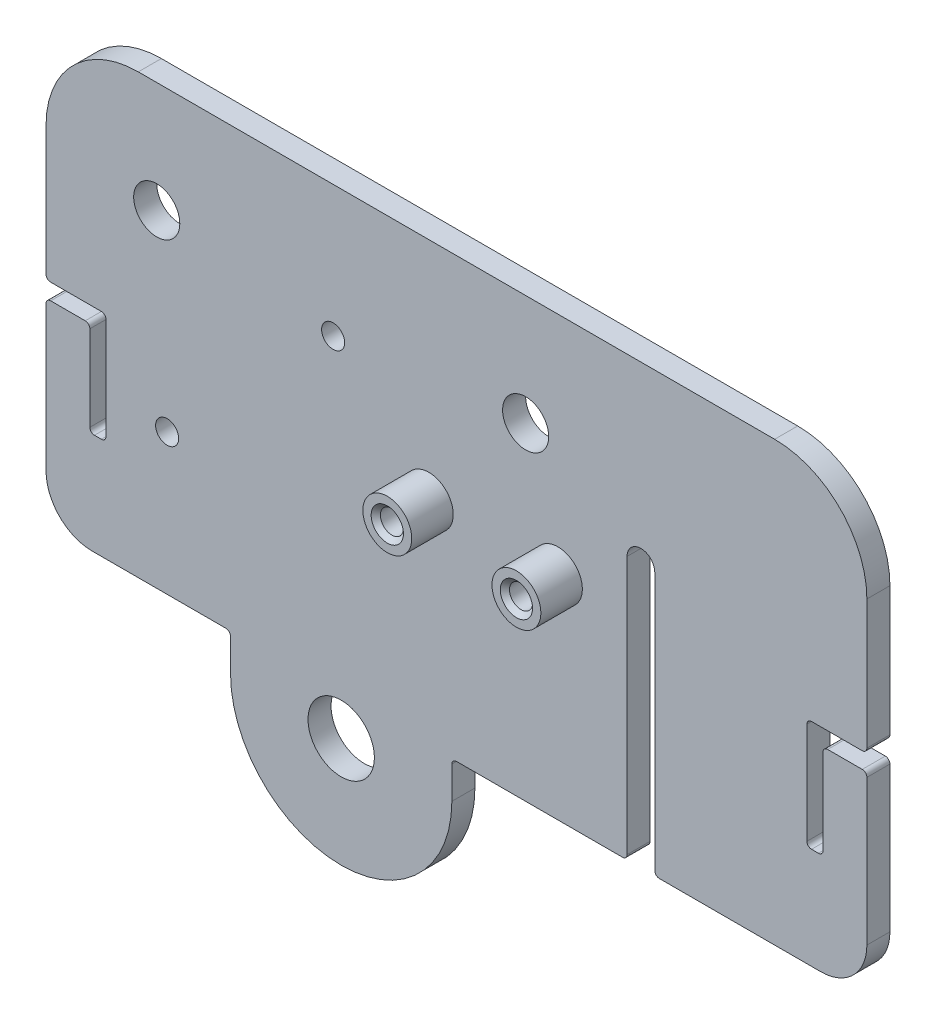
from build123d import *

# Parameters (mm, degrees)
SKETCH1_R                       = 3.6
SKETCH1_R_2                     = 2.5
BOSS_EXTRUDE1_DEPTH             = 1.25
FILLET1_R                       = 5
FILLET2_R                       = 10
CUT_EXTRUDE1_DEPTH              = 60.720704115
FILLET3_R                       = 0.5
SKETCH3_R                       = 2.65
BOSS_EXTRUDE2_DEPTH             = 4.5
M3X0_5_TAPPED_HOLE1_D           = 2.5
M3X0_5_TAPPED_HOLE1_DEPTH       = 6
M3X0_5_TAPPED_HOLE1_CSINK_D     = 3.5
M3X0_5_TAPPED_HOLE1_CSINK_ANGLE = 90
M3X0_5_TAPPED_HOLE1_TIP         = 0.751075774
SKETCH7_R                       = 2.625
BOSS_EXTRUDE3_DEPTH             = 1.5
M3X0_5_TAPPED_HOLE2_D           = 2.5
M3X0_5_TAPPED_HOLE2_CSINK_D     = 3.5
M3X0_5_TAPPED_HOLE2_CSINK_ANGLE = 90


with BuildPart() as part:
    # Sketch1 → Boss-Extrude1 (new, symmetric)
    with BuildSketch(Plane.XY):
        with BuildLine():
            Line((-0.5, -27.75), (-0.5, -23.75))
            Line((-0.5, -23.75), (44.5, -23.75))
            Line((44.5, -23.75), (44.5, 23.75))
            Line((44.5, 23.75), (-44.5, 23.75))
            Line((-44.5, 23.75), (-44.5, -23.75))
            Line((-44.5, -23.75), (-24.5, -23.75))
            Line((-24.5, -23.75), (-24.5, -27.75))
            ThreePointArc((-24.5, -27.75), (-12.5, -39.75), (-0.5, -27.75))
        make_face()
        with Locations((-12.5, -27.85)):
            Circle(SKETCH1_R, mode=Mode.SUBTRACT)
        with Locations((7.5, 11.75)):
            Circle(SKETCH1_R_2, mode=Mode.SUBTRACT)
        with Locations((-32.5, 11.75)):
            Circle(SKETCH1_R_2, mode=Mode.SUBTRACT)
    extrude(amount=BOSS_EXTRUDE1_DEPTH, both=True)

    # Fillet1
    fillet1_edges = [part.edges().sort_by_distance(p)[0] for p in [
        (44.5, -23.75, 0),
        (-44.5, -23.75, 0),
    ]]
    fillet(fillet1_edges, radius=FILLET1_R)

    # Fillet2
    fillet2_edges = [part.edges().sort_by_distance(p)[0] for p in [
        (-44.5, 23.75, 0),
        (44.5, 23.75, 0),
    ]]
    fillet(fillet2_edges, radius=FILLET2_R)

    # Sketch2 → Cut-Extrude1 (cut, through all)
    with BuildSketch(Plane.XY.offset(1.25)):
        with BuildLine():
            Line((18.5, -23.75), (21.5, -23.75))
            Line((21.5, -23.75), (21.5, 4.75))
            ThreePointArc((21.5, 4.75), (20, 6.25), (18.5, 4.75))
            Line((18.5, 4.75), (18.5, -23.75))
        make_face()
        Polygon((44.5, -0.75), (38, -0.75), (38, -12.75), (39.75, -12.75), (39.75, -2.5), (44.5, -2.5), align=None)
        Polygon((-38, -12.75), (-39.75, -12.75), (-39.75, -2.5), (-44.5, -2.5), (-44.5, -0.75), (-38, -0.75), align=None)
    extrude(amount=-CUT_EXTRUDE1_DEPTH, mode=Mode.SUBTRACT)

    # Fillet3
    fillet3_edges = [part.edges().sort_by_distance(p)[0] for p in [
        (-0.5, -23.75, 0),
        (-24.5, -23.75, 0),
        (44.5, -0.75, 0),
        (44.5, -2.5, 0),
        (39.75, -2.5, 0),
        (39.75, -12.75, 0),
        (38, -12.75, 0),
        (38, -0.75, 0),
        (-38, -0.75, 0),
        (-38, -12.75, 0),
        (-39.75, -12.75, 0),
        (-39.75, -2.5, 0),
        (-44.5, -2.5, 0),
        (-44.5, -0.75, 0),
        (18.5, -23.75, 0),
        (21.5, -23.75, 0),
    ]]
    fillet(fillet3_edges, radius=FILLET3_R)

    # Sketch3 → Boss-Extrude2 (add)
    with BuildSketch(Plane.XY.offset(1.25)):
        with Locations((11, -0.75)):
            Circle(SKETCH3_R)
        with Locations((-3, -0.75)):
            Circle(SKETCH3_R)
    extrude(amount=BOSS_EXTRUDE2_DEPTH)

    # M3x0.5 Tapped Hole1
    with Locations(Plane.XY.offset(5.75)):
        with Locations((-3, -0.75), (11, -0.75)):
            CounterSinkHole(M3X0_5_TAPPED_HOLE1_D / 2, M3X0_5_TAPPED_HOLE1_CSINK_D / 2, depth=M3X0_5_TAPPED_HOLE1_DEPTH, counter_sink_angle=M3X0_5_TAPPED_HOLE1_CSINK_ANGLE)
            with Locations((0, 0, -(M3X0_5_TAPPED_HOLE1_DEPTH + M3X0_5_TAPPED_HOLE1_TIP / 2))):  # 118° drill point
                Cone(0, M3X0_5_TAPPED_HOLE1_D / 2, M3X0_5_TAPPED_HOLE1_TIP, mode=Mode.SUBTRACT)

    # Sketch7 → Boss-Extrude3 (add)
    with BuildSketch(Plane(origin=(0, 0, -1.25), x_dir=(-1, 0, 0), z_dir=(0, 0, -1))):
        with Locations(Location((13.375, 9.5, 0), (0, 0, 180))):
            Circle(SKETCH7_R)
        with Locations(Location((31.375, -8.5, 0), (0, 0, 180))):
            Circle(SKETCH7_R)
    extrude(amount=BOSS_EXTRUDE3_DEPTH)

    # M3x0.5 Tapped Hole2 (through all)
    with Locations(Plane(origin=(0, 0, -2.75), x_dir=(-1, 0, 0), z_dir=(0, 0, -1))):
        with Locations((13.375, 9.5), (31.375, -8.5)):
            CounterSinkHole(M3X0_5_TAPPED_HOLE2_D / 2, M3X0_5_TAPPED_HOLE2_CSINK_D / 2, counter_sink_angle=M3X0_5_TAPPED_HOLE2_CSINK_ANGLE)


solid = part.part
